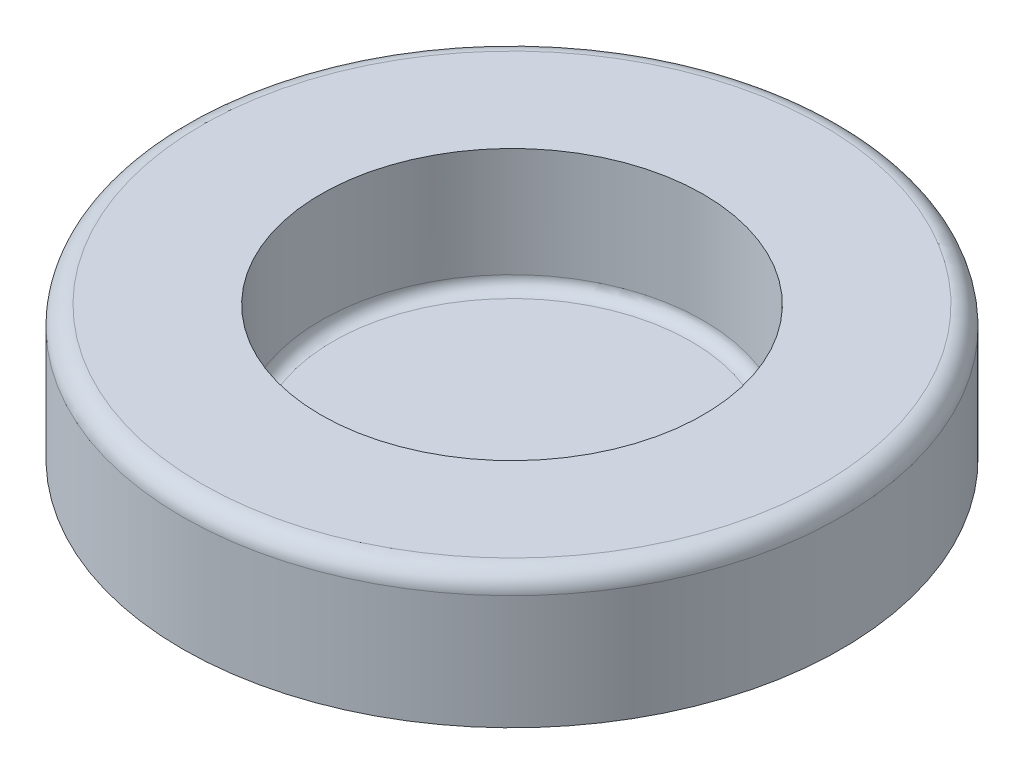
from build123d import *

# Parameters (mm, degrees)
SKETCH1_R           = 6.8961
SKETCH1_R_2         = 4.0005
BOSS_EXTRUDE1_DEPTH = 2.794
SKETCH2_R           = 4.0005
BOSS_EXTRUDE2_DEPTH = 0.254
FILLET1_R           = 0.254
FILLET3_R           = 0.4


with BuildPart() as part:
    # Sketch1 → Boss-Extrude1 (new body)
    with BuildSketch(Plane(origin=(0, 0, 0), x_dir=(1, 0, 0), z_dir=(0, 1, 0))):
        with Locations(Location((0, 0, 0), (0, 0, 270))):
            Circle(SKETCH1_R)
        with Locations(Location((0, 0, 0), (0, 0, 270))):
            Circle(SKETCH1_R_2, mode=Mode.SUBTRACT)
    extrude(amount=BOSS_EXTRUDE1_DEPTH)

    # Sketch2 → Boss-Extrude2 (add)
    with BuildSketch(Plane.XZ):
        with Locations(Location((0, 0, 0), (0, 0, 270))):
            Circle(SKETCH2_R)
    extrude(amount=-BOSS_EXTRUDE2_DEPTH)

    # Fillet1
    fillet1_edges = [part.edges().sort_by_distance(p)[0] for p in [
        (0, 0.254, -4.0005),
    ]]
    fillet(fillet1_edges, radius=FILLET1_R)

    # Fillet3
    fillet3_edges = [part.edges().sort_by_distance(p)[0] for p in [
        (0, 2.794, -6.8961),
    ]]
    fillet(fillet3_edges, radius=FILLET3_R)


solid = part.part
